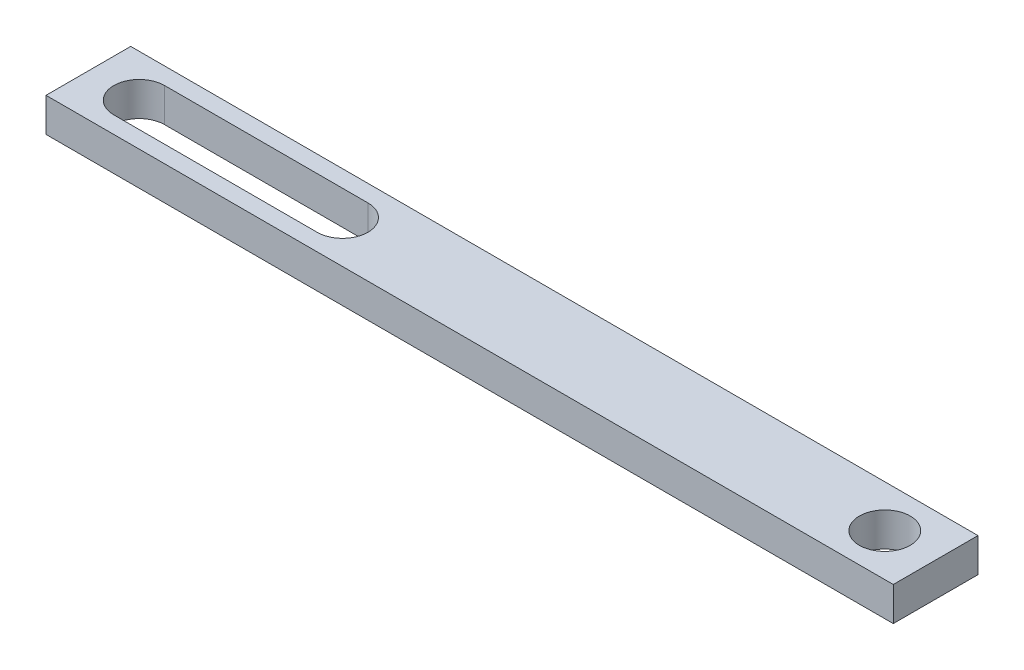
from build123d import *

# Parameters (mm, degrees)
SKETCH2_W           = 50
SKETCH2_H           = 5
SKETCH2_R           = 1.5
BOSS_EXTRUDE1_DEPTH = 2


with BuildPart() as part:
    # Sketch2 → Boss-Extrude1 (new body)
    with BuildSketch(Plane(origin=(0, 0, 0), x_dir=(1, 0, 0), z_dir=(0, 1, 0))):
        with Locations((25, 2.5)):
            Rectangle(SKETCH2_W, SKETCH2_H)
        with Locations(Location((47, 2.5, 0), (0, 0, 270))):
            Circle(SKETCH2_R, mode=Mode.SUBTRACT)
        with BuildLine():
            Line((3, 4), (15, 4))
            ThreePointArc((15, 4), (16.5, 2.5), (15, 1))
            Line((15, 1), (3, 1))
            ThreePointArc((3, 1), (1.5, 2.5), (3, 4))
        make_face(mode=Mode.SUBTRACT)
    extrude(amount=BOSS_EXTRUDE1_DEPTH)


solid = part.part
